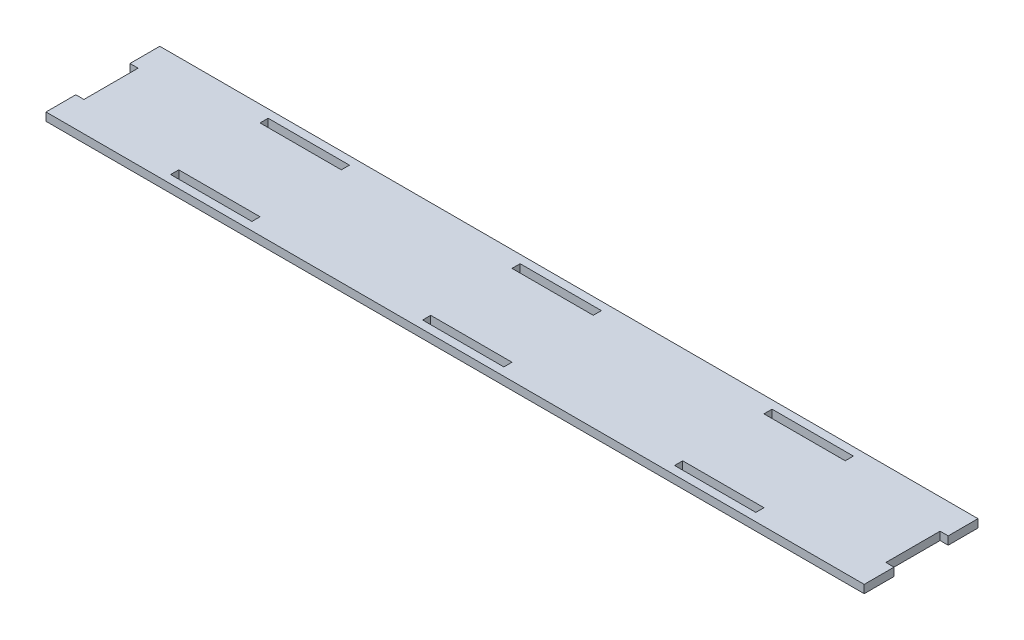
from build123d import *

# Parameters (mm, degrees)
SKETCH1_W           = 30
SKETCH1_H           = 3.002768409
SKETCH1_H_2         = 3
BOSS_EXTRUDE1_DEPTH = 3


with BuildPart() as part:
    # Sketch1 → Boss-Extrude1 (new body)
    with BuildSketch(Plane(origin=(0, 0, 0), x_dir=(1, 0, 0), z_dir=(0, 1, 0))):
        Polygon((0, 31), (0, 42), (302, 42), (302, 31), (299, 31), (299, 11), (302, 11), (302, 0), (0, 0), (0, 11), (3, 11), (3, 31), align=None)
        with Locations((244, 4.501384205)):
            Rectangle(SKETCH1_W, SKETCH1_H, mode=Mode.SUBTRACT)
        with Locations((58, 37.497231591)):
            Rectangle(SKETCH1_W, SKETCH1_H_2, mode=Mode.SUBTRACT)
        with Locations((151, 37.5)):
            Rectangle(SKETCH1_W, SKETCH1_H_2, mode=Mode.SUBTRACT)
        with Locations((244, 37.498615796)):
            Rectangle(SKETCH1_W, SKETCH1_H, mode=Mode.SUBTRACT)
        with Locations((151, 4.5)):
            Rectangle(SKETCH1_W, SKETCH1_H_2, mode=Mode.SUBTRACT)
        with Locations((58, 4.502768409)):
            Rectangle(SKETCH1_W, SKETCH1_H_2, mode=Mode.SUBTRACT)
    extrude(amount=BOSS_EXTRUDE1_DEPTH)


solid = part.part
